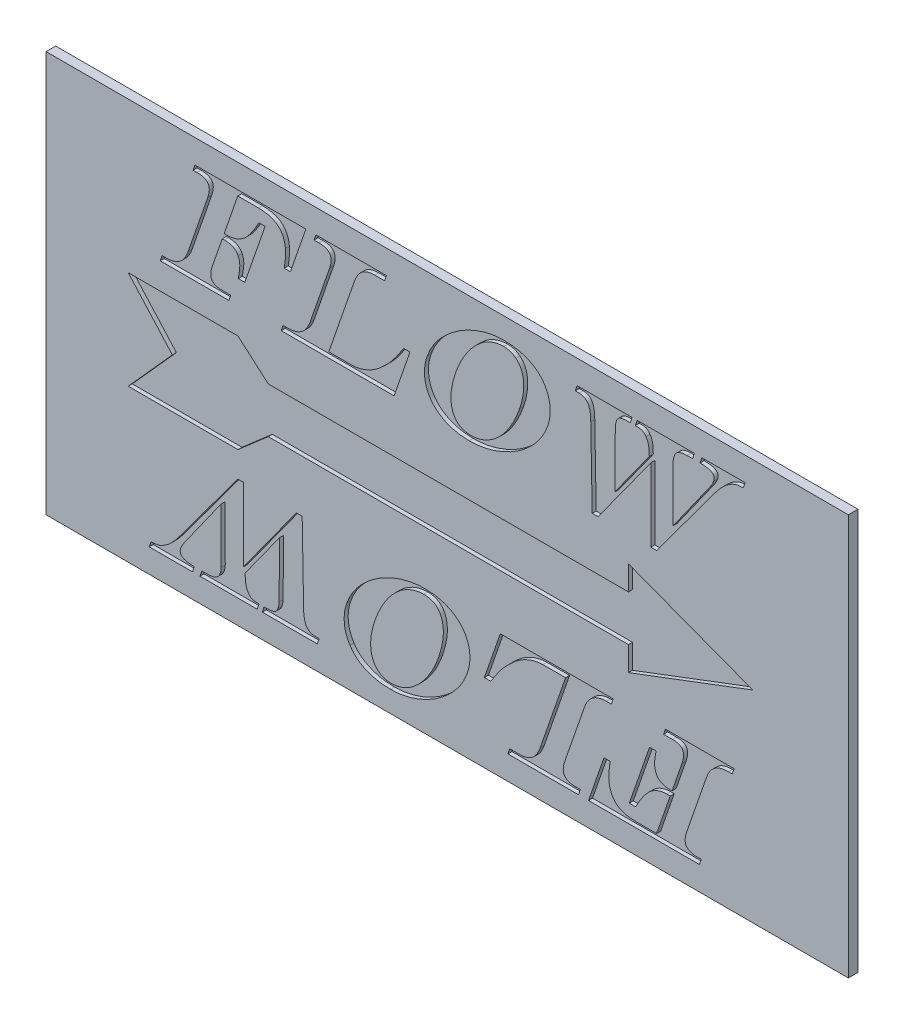
from build123d import *

# Parameters (mm, degrees)
SKETCH1_W           = 50.8
SKETCH1_H           = 25.4
BOSS_EXTRUDE1_DEPTH = 0.6096
CUT_EXTRUDE1_DEPTH  = 0.254
CUT_EXTRUDE2_DEPTH  = 0.254
CIRPATTERN3_COUNT   = 2


with BuildPart() as part:
    # Sketch1 → Boss-Extrude1 (new body)
    with BuildSketch(Plane.XY):
        Rectangle(SKETCH1_W, SKETCH1_H)
    extrude(amount=BOSS_EXTRUDE1_DEPTH)

    # Sketch2 → Cut-Extrude1 (cut)
    with BuildSketch(Plane.XY.offset(0.6096)):
        Polygon((-11.327711753, 1.509598775), (-13.244593022, 3.179140525), (-20.194443984, 3.179140525), (-17.401103691, 0.06572999), (-20.194443984, -3.047680545), (-13.244593022, -3.047680545), (-11.327711753, -1.378138794), (11.478647286, -1.378138794), (11.478647286, -2.916220564), (19.346527111, 0.06572999), (11.478647286, 3.047680545), (11.478647286, 1.509598775), align=None)
    extrude(amount=-CUT_EXTRUDE1_DEPTH, mode=Mode.SUBTRACT)

    # Sketch3 → Cut-Extrude2 (cut)
    # profile 1 of 4: a face of its own
    with BuildSketch(Plane.XY.offset(0.6096)):
        with BuildLine():
            Line((-13.259375867, 10.848866034), (-14.120165563, 8.36035252))
            Line((-14.120165563, 8.36035252), (-13.901616154, 8.36035252))
            add(Edge.make_bspline(
                [(-13.901616154, 8.36035252), (-13.853736727, 8.36123528), (-13.759434535, 8.362973942), (-13.61991226, 8.381258622), (-13.484298786, 8.410384357), (-13.352663489, 8.452540432), (-13.224510463, 8.50470564), (-13.100654621, 8.569428516), (-12.981479527, 8.646482671), (-12.863842128, 8.734424076), (-12.750015502, 8.839514368), (-12.633589479, 8.958785147), (-12.519350248, 9.098524935), (-12.400815077, 9.252921036), (-12.284659851, 9.427887506), (-12.165732759, 9.618546494), (-12.04584109, 9.827393051), (-11.96903337, 9.973952228), (-11.929308299, 10.049752858)],
                knots=[0, 0, 0, 0, 0.835921273, 1.646410856, 2.453396133, 3.255837111, 4.057556213, 4.867669717, 5.692766577, 6.53435567, 7.429735418, 8.395931348, 9.443481709, 10.580182804, 11.794901575, 13.109847871, 14.505208907, 16, 16, 16, 16], degree=3))
            Line((-11.929308299, 10.049752858), (-11.528410917, 10.049752858))
            Line((-11.528410917, 10.049752858), (-12.814232286, 6.33843529))
            Line((-12.814232286, 6.33843529), (-13.224515225, 6.33843529))
            add(Edge.make_bspline(
                [(-13.224515225, 6.33843529), (-13.209247687, 6.420575718), (-13.180859041, 6.573308627), (-13.148946441, 6.786523134), (-13.132463527, 6.966007982), (-13.127562639, 7.116348587), (-13.139929518, 7.245841422), (-13.158697106, 7.365330987), (-13.192423674, 7.477536098), (-13.22295389, 7.548095875), (-13.237923164, 7.582692047)],
                knots=[0, 0, 0, 0, 1.58301381, 2.943475083, 4.082757694, 4.997482363, 5.787935338, 6.543887119, 7.286053135, 8, 8, 8, 8], degree=3))
            add(Edge.make_bspline(
                [(-13.237923164, 7.582692047), (-13.255967714, 7.617382738), (-13.291634178, 7.685951601), (-13.365435188, 7.775676962), (-13.454613932, 7.849662631), (-13.556265061, 7.913193242), (-13.674552035, 7.958433838), (-13.805087168, 7.99397378), (-13.950638563, 8.013639571), (-14.052176308, 8.01591577), (-14.10541683, 8.017109277)],
                knots=[0, 0, 0, 0, 0.910688587, 1.800047178, 2.688059461, 3.605649105, 4.583658891, 5.630999447, 6.757833114, 8, 8, 8, 8], degree=3))
            Line((-14.10541683, 8.017109277), (-14.239496222, 8.017109277))
            Line((-14.239496222, 8.017109277), (-14.860283806, 6.224467807))
            add(Edge.make_bspline(
                [(-14.860283806, 6.224467807), (-14.875112021, 6.179483697), (-14.9033827, 6.093719407), (-14.935669905, 5.968377043), (-14.958409856, 5.852938465), (-14.967086005, 5.746913332), (-14.968845849, 5.651079552), (-14.95650563, 5.565298269), (-14.934399505, 5.489300263), (-14.899914334, 5.423008356), (-14.854906158, 5.366223784), (-14.800349535, 5.31678894), (-14.734796145, 5.276974178), (-14.660445662, 5.243471261), (-14.576469559, 5.21637515), (-14.482400793, 5.198218976), (-14.378283385, 5.187733188), (-14.30566774, 5.186170565), (-14.267652894, 5.18535252)],
                knots=[0, 0, 0, 0, 1.487891068, 2.836733282, 4.065205791, 5.178995715, 6.176090192, 7.069818416, 7.891698109, 8.651740206, 9.401856929, 10.157605336, 10.952526785, 11.800973151, 12.715856344, 13.718375481, 14.805552092, 16, 16, 16, 16], degree=3))
            Line((-14.267652894, 5.18535252), (-13.700497066, 5.18535252))
            Line((-13.700497066, 5.18535252), (-13.819827725, 4.842109277))
            Line((-13.819827725, 4.842109277), (-18.168022404, 4.842109277))
            Line((-18.168022404, 4.842109277), (-18.048691745, 5.18535252))
            Line((-18.048691745, 5.18535252), (-17.80734884, 5.18535252))
            add(Edge.make_bspline(
                [(-17.80734884, 5.18535252), (-17.763511562, 5.186032071), (-17.677898825, 5.187359211), (-17.552643563, 5.200436853), (-17.433051083, 5.217809347), (-17.320431066, 5.246841063), (-17.213507306, 5.281443881), (-17.112805731, 5.324183714), (-17.018305039, 5.375703638), (-16.929534282, 5.434473658), (-16.846781124, 5.502668053), (-16.768920344, 5.579542826), (-16.695210117, 5.664762548), (-16.628358483, 5.759842855), (-16.564887472, 5.862188874), (-16.505898354, 5.973575035), (-16.452316015, 6.094160171), (-16.421789281, 6.178678069), (-16.406219195, 6.221786219)],
                knots=[0, 0, 0, 0, 1.115139241, 2.177829621, 3.202531188, 4.187320628, 5.133249574, 6.060672428, 6.966574419, 7.868756059, 8.765833071, 9.690741823, 10.650518341, 11.628916185, 12.645251667, 13.713708509, 14.833882525, 16, 16, 16, 16], degree=3))
            Line((-16.406219195, 6.221786219), (-15.161962438, 9.812432334))
            add(Edge.make_bspline(
                [(-15.161962438, 9.812432334), (-15.148169353, 9.855665006), (-15.121757023, 9.938451099), (-15.089981057, 10.058963926), (-15.0709635, 10.171182512), (-15.062574465, 10.273931284), (-15.064252307, 10.368612637), (-15.079232952, 10.453718453), (-15.102839583, 10.531289047), (-15.139946104, 10.599088719), (-15.187540168, 10.659496052), (-15.247839928, 10.710934975), (-15.319693038, 10.75372665), (-15.40295288, 10.788309803), (-15.497075466, 10.817005565), (-15.603935372, 10.834256334), (-15.721662652, 10.846952038), (-15.804162038, 10.84821078), (-15.84710813, 10.848866034)],
                knots=[0, 0, 0, 0, 1.369935481, 2.623284654, 3.758979805, 4.801050224, 5.73242248, 6.608603103, 7.402254699, 8.168955411, 8.927540133, 9.711962908, 10.547299015, 11.441983851, 12.428043378, 13.51055757, 14.704089432, 16, 16, 16, 16], degree=3))
            Line((-15.84710813, 10.848866034), (-16.088451036, 10.848866034))
            Line((-16.088451036, 10.848866034), (-15.969120377, 11.192109277))
            Line((-15.969120377, 11.192109277), (-8.947382624, 11.192109277))
            Line((-8.947382624, 11.192109277), (-9.927502978, 8.361693314))
            Line((-9.927502978, 8.361693314), (-10.316333215, 8.361693314))
            add(Edge.make_bspline(
                [(-10.316333215, 8.361693314), (-10.306552274, 8.426445573), (-10.287828465, 8.550401838), (-10.267162283, 8.729416108), (-10.249079434, 8.892457174), (-10.236936471, 9.040432649), (-10.229696221, 9.172360958), (-10.228950174, 9.288153351), (-10.229589519, 9.387724334), (-10.237589746, 9.448223137), (-10.241248755, 9.475893061)],
                knots=[0, 0, 0, 0, 1.403576064, 2.68688767, 3.862250417, 4.919559254, 5.869176888, 6.693102873, 7.402273387, 8, 8, 8, 8], degree=3))
            add(Edge.make_bspline(
                [(-10.241248755, 9.475893061), (-10.251242505, 9.551269771), (-10.270476069, 9.696336712), (-10.324467798, 9.901584715), (-10.396836139, 10.086030359), (-10.488297776, 10.250591543), (-10.600776684, 10.394642004), (-10.7344338, 10.518404467), (-10.88868011, 10.622325721), (-11.064532016, 10.705207849), (-11.25962378, 10.771305336), (-11.475893838, 10.815141812), (-11.711755935, 10.844223874), (-11.87602683, 10.847277441), (-11.961487353, 10.848866034)],
                knots=[0, 0, 0, 0, 1.10546836, 2.127539288, 3.079077017, 3.981649112, 4.857109305, 5.726754031, 6.621326112, 7.552038254, 8.547320977, 9.610993619, 10.75713994, 12, 12, 12, 12], degree=3))
            Line((-11.961487353, 10.848866034), (-13.259375867, 10.848866034))
        make_face()
    # profile 2 of 4: a face of its own
    with BuildSketch(Plane.XY.offset(0.6096)):
        with BuildLine():
            Line((-8.311846306, 11.192109277), (-3.844320968, 11.192109277))
            Line((-3.844320968, 11.192109277), (-3.963651627, 10.848866034))
            Line((-3.963651627, 10.848866034), (-4.584439211, 10.848866034))
            add(Edge.make_bspline(
                [(-4.584439211, 10.848866034), (-4.660641359, 10.846232708), (-4.808168462, 10.841134599), (-5.019723417, 10.796247564), (-5.211857348, 10.721840512), (-5.356750547, 10.635259718), (-5.460488531, 10.54891264), (-5.534941469, 10.474732701), (-5.604475754, 10.38922411), (-5.671596343, 10.294716798), (-5.732961442, 10.188621765), (-5.792548546, 10.073771977), (-5.845314928, 9.947139127), (-5.877738784, 9.859033076), (-5.89439487, 9.813773128)],
                knots=[0, 0, 0, 0, 1.515961848, 2.934897059, 4.281708241, 5.603354257, 6.273311375, 6.965476594, 7.692406687, 8.465170106, 9.270991904, 10.130637515, 11.039711271, 12, 12, 12, 12], degree=3))
            Line((-5.89439487, 9.813773128), (-7.496643603, 5.18535252))
            Line((-7.496643603, 5.18535252), (-6.060653316, 5.18535252))
            add(Edge.make_bspline(
                [(-6.060653316, 5.18535252), (-5.984496146, 5.187483928), (-5.829866407, 5.191811546), (-5.598086029, 5.233956634), (-5.362644858, 5.294543178), (-5.128113958, 5.384703198), (-4.894210941, 5.493693573), (-4.665991203, 5.624208968), (-4.445126936, 5.774697388), (-4.306091221, 5.888217801), (-4.235832792, 5.945582672)],
                knots=[0, 0, 0, 0, 0.905491289, 1.838512123, 2.795808633, 3.795605345, 4.823543727, 5.864609099, 6.920930422, 8, 8, 8, 8], degree=3))
            add(Edge.make_bspline(
                [(-4.235832792, 5.945582672), (-4.150701622, 6.021742916), (-3.986421099, 6.168711936), (-3.791707939, 6.360977987), (-3.643467531, 6.518682982), (-3.533515697, 6.649490461), (-3.416963893, 6.789530621), (-3.300317726, 6.946114663), (-3.175481015, 7.117787542), (-3.043242552, 7.309185335), (-2.90271269, 7.521819437), (-2.806011757, 7.670233423), (-2.755596306, 7.747609699)],
                knots=[0, 0, 0, 0, 1.463045253, 2.823288302, 3.503831384, 4.234720844, 5.01175685, 5.837326203, 6.735148315, 7.730891246, 8.816990291, 10, 10, 10, 10], degree=3))
            Line((-2.755596306, 7.747609699), (-2.356039718, 7.747609699))
            Line((-2.356039718, 7.747609699), (-3.361635157, 4.842109277))
            Line((-3.361635157, 4.842109277), (-10.506725951, 4.842109277))
            Line((-10.506725951, 4.842109277), (-10.400803232, 5.18535252))
            Line((-10.400803232, 5.18535252), (-10.084375867, 5.18535252))
            add(Edge.make_bspline(
                [(-10.084375867, 5.18535252), (-10.041886077, 5.186099618), (-9.958072458, 5.187573312), (-9.835330359, 5.199934429), (-9.717614171, 5.219334092), (-9.606042446, 5.249960695), (-9.498887312, 5.285201888), (-9.397184048, 5.329679955), (-9.301750138, 5.384131915), (-9.21092423, 5.445216552), (-9.125231115, 5.514733199), (-9.044885212, 5.591935767), (-8.971247897, 5.679085847), (-8.900916388, 5.772283581), (-8.838504399, 5.875511557), (-8.778823247, 5.984916471), (-8.726969408, 6.103852911), (-8.696261766, 6.186329703), (-8.680564634, 6.228490189)],
                knots=[0, 0, 0, 0, 1.080834128, 2.132009167, 3.1359294, 4.11235942, 5.072496658, 6.004268698, 6.930961408, 7.864535852, 8.786261539, 9.73522259, 10.694820954, 11.686429042, 12.702575872, 13.760800713, 14.855366119, 16, 16, 16, 16], degree=3))
            Line((-8.680564634, 6.228490189), (-7.438989465, 9.813773128))
            add(Edge.make_bspline(
                [(-7.438989465, 9.813773128), (-7.425417411, 9.855160732), (-7.399240969, 9.934985074), (-7.371431666, 10.052500614), (-7.353081578, 10.162252953), (-7.346307587, 10.263713972), (-7.349079842, 10.357591632), (-7.366256187, 10.442910196), (-7.390264974, 10.521630925), (-7.429065246, 10.591089194), (-7.477877713, 10.652420317), (-7.538481681, 10.705487276), (-7.609349176, 10.750838385), (-7.691706332, 10.787353845), (-7.78459075, 10.814996208), (-7.888357057, 10.834741152), (-8.002732443, 10.846812356), (-8.082539081, 10.848162384), (-8.124135157, 10.848866034)],
                knots=[0, 0, 0, 0, 1.329031412, 2.56330513, 3.682510207, 4.72160118, 5.663840729, 6.538787221, 7.371442573, 8.165188438, 8.951394843, 9.753537901, 10.612598371, 11.510225422, 12.494207784, 13.564447061, 14.73056365, 16, 16, 16, 16], degree=3))
            Line((-8.124135157, 10.848866034), (-8.431176965, 10.848866034))
            Line((-8.431176965, 10.848866034), (-8.311846306, 11.192109277))
        make_face()
    # profile 3 of 4: a face of its own
    with BuildSketch(Plane.XY.offset(0.6096)):
        with BuildLine():
            add(Edge.make_bspline(
                [(3.587699724, 11.363730898), (3.662368413, 11.363243681), (3.809179263, 11.362285732), (4.025164761, 11.346273376), (4.233321914, 11.324326596), (4.433382374, 11.292073019), (4.625470447, 11.250714824), (4.809842736, 11.199469176), (4.986553351, 11.139818902), (5.154560018, 11.069488247), (5.313580325, 10.992222467), (5.463503696, 10.90763185), (5.602805756, 10.814694322), (5.733711621, 10.715987698), (5.853022032, 10.607909752), (5.963654943, 10.493631343), (6.064720476, 10.372075449), (6.123403686, 10.284910318), (6.152638491, 10.241486388)],
                knots=[0, 0, 0, 0, 1.226907228, 2.412300225, 3.557690248, 4.666286615, 5.741101131, 6.785437922, 7.809847966, 8.804324582, 9.7767453, 10.714276506, 11.631060663, 12.527249664, 13.406296191, 14.273850611, 15.140066813, 16, 16, 16, 16], degree=3))
            add(Edge.make_bspline(
                [(6.152638491, 10.241486388), (6.201699552, 10.15856654), (6.298571523, 9.994839768), (6.405741992, 9.731639765), (6.480266974, 9.460690533), (6.520206948, 9.18182603), (6.527393359, 8.898540617), (6.506142736, 8.61223414), (6.452976762, 8.324250628), (6.393330101, 8.136342968), (6.363143137, 8.041243567)],
                knots=[0, 0, 0, 0, 1.009060396, 1.992408371, 2.968921779, 3.949060082, 4.93820806, 5.934467647, 6.95464139, 8, 8, 8, 8], degree=3))
            add(Edge.make_bspline(
                [(6.363143137, 8.041243567), (6.336291701, 7.968500705), (6.282421131, 7.822560668), (6.185482666, 7.608513763), (6.07212861, 7.399709807), (5.945783877, 7.1935823), (5.804717486, 6.99163827), (5.6504664, 6.792038814), (5.479539193, 6.598464936), (5.296590966, 6.408272843), (5.101522361, 6.225697357), (4.897461551, 6.051306232), (4.685736081, 5.885527816), (4.463477292, 5.732020331), (4.234231165, 5.58513305), (3.995842976, 5.448421187), (3.748141992, 5.322894435), (3.494751048, 5.204669369), (3.236184266, 5.099294818), (2.975160585, 5.008058698), (2.713660057, 4.929595592), (2.450690529, 4.867232835), (2.187332459, 4.816656505), (1.922675268, 4.782588929), (1.65735789, 4.759804897), (1.48001872, 4.757466132), (1.391479285, 4.756298466)],
                knots=[0, 0, 0, 0, 0.884504431, 1.774532993, 2.67800114, 3.593661773, 4.531501607, 5.487233868, 6.470126639, 7.476275611, 8.497201687, 9.517095746, 10.538123693, 11.563687334, 12.597734781, 13.643857171, 14.697459211, 15.765181815, 16.833306165, 17.881563956, 18.918962943, 19.946742652, 20.963841199, 21.977097758, 22.990033494, 24, 24, 24, 24], degree=3))
            add(Edge.make_bspline(
                [(1.391479285, 4.756298466), (1.264868433, 4.759495175), (1.017948439, 4.765729487), (0.658907311, 4.811009643), (0.322429218, 4.888945136), (0.009850823, 4.996965321), (-0.27738608, 5.133790925), (-0.536616085, 5.297755986), (-0.76703531, 5.488601893), (-0.934758877, 5.668774801), (-1.051310666, 5.825325325), (-1.130540389, 5.946938227), (-1.200103198, 6.07366444), (-1.26250957, 6.203968253), (-1.314885591, 6.339820732), (-1.357197056, 6.480790829), (-1.392713612, 6.626086042), (-1.417758605, 6.775788997), (-1.433799578, 6.92892191), (-1.440872679, 7.084763019), (-1.436407097, 7.242398481), (-1.422786237, 7.401727058), (-1.400296716, 7.563037149), (-1.366107703, 7.726194844), (-1.323962513, 7.891729582), (-1.287243459, 8.000786454), (-1.26865585, 8.055992301)],
                knots=[0, 0, 0, 0, 1.787327059, 3.485694765, 5.098939096, 6.655470209, 8.14565291, 9.581057397, 10.974704654, 12.358906261, 13.044170513, 13.728504489, 14.406349524, 15.083753875, 15.766923224, 16.459555965, 17.160502825, 17.877316892, 18.600628104, 19.333264634, 20.078082068, 20.82532784, 21.590085138, 22.375898506, 23.177861099, 24, 24, 24, 24], degree=3))
            add(Edge.make_bspline(
                [(-1.26865585, 8.055992301), (-1.241395569, 8.12965131), (-1.186705517, 8.277427304), (-1.087931044, 8.493632647), (-0.975517696, 8.706403786), (-0.845777148, 8.913259732), (-0.704817611, 9.118705446), (-0.548196365, 9.319383351), (-0.375314139, 9.514960542), (-0.191440519, 9.707764967), (0.004574974, 9.892510322), (0.208935944, 10.068902779), (0.420941336, 10.234810406), (0.639226749, 10.392073311), (0.865436769, 10.538404004), (1.098549104, 10.675647577), (1.340339296, 10.801024414), (1.587290114, 10.917808401), (1.838059792, 11.021522494), (2.089337129, 11.113214744), (2.339775374, 11.191170145), (2.589903679, 11.254634044), (2.839806202, 11.30276144), (3.089515811, 11.337489754), (3.338785878, 11.36015747), (3.504969739, 11.36254322), (3.587699724, 11.363730898)],
                knots=[0, 0, 0, 0, 0.909613569, 1.824882668, 2.751359265, 3.695334997, 4.651836311, 5.63678154, 6.64207872, 7.674735924, 8.722213324, 9.761146563, 10.801046942, 11.839889869, 12.876756862, 13.921030372, 14.972416046, 16.03089142, 17.084721943, 18.114949102, 19.128650846, 20.121943447, 21.102838669, 22.075224971, 23.041804609, 24, 24, 24, 24], degree=3))
        make_face()
        with BuildLine():
            add(Edge.make_bspline(
                [(3.585018137, 11.020487655), (3.525511672, 11.018803656), (3.406075563, 11.015423682), (3.226975159, 10.99212384), (3.047883396, 10.952459234), (2.868313832, 10.89915), (2.688752818, 10.829506435), (2.512483851, 10.739919373), (2.336424679, 10.63594282), (2.225621334, 10.553176022), (2.169139758, 10.510985966)],
                knots=[0, 0, 0, 0, 0.931987919, 1.870603694, 2.823520246, 3.802462728, 4.802135171, 5.835244061, 6.89652403, 8, 8, 8, 8], degree=3))
            add(Edge.make_bspline(
                [(2.169139758, 10.510985966), (2.117269122, 10.469085808), (2.010520288, 10.382856039), (1.854556898, 10.238363191), (1.698291156, 10.075616758), (1.540642229, 9.897519012), (1.388309604, 9.703787536), (1.239381865, 9.500364511), (1.102217782, 9.283343944), (0.970410438, 9.056984595), (0.847215372, 8.819904999), (0.732926499, 8.571318876), (0.625752463, 8.312418959), (0.56170195, 8.13403191), (0.529348795, 8.043925155)],
                knots=[0, 0, 0, 0, 0.799370464, 1.645089999, 2.547089665, 3.503936107, 4.495711611, 5.501204713, 6.525459319, 7.572384686, 8.641406164, 9.727590643, 10.852162009, 12, 12, 12, 12], degree=3))
            add(Edge.make_bspline(
                [(0.529348795, 8.043925155), (0.492209721, 7.932612044), (0.420444941, 7.717518885), (0.338783071, 7.398458493), (0.280227158, 7.096740346), (0.245875936, 6.812181813), (0.235846958, 6.546168368), (0.248711965, 6.300179614), (0.282643305, 6.073762365), (0.339748967, 5.868785814), (0.417126623, 5.68544245), (0.5154154, 5.527119945), (0.632207753, 5.39278343), (0.76825219, 5.284235609), (0.922081001, 5.20006248), (1.093418762, 5.141172984), (1.281458944, 5.106226111), (1.412331537, 5.101819316), (1.479971684, 5.099541709)],
                knots=[0, 0, 0, 0, 1.523101799, 2.94312839, 4.272331675, 5.510997254, 6.660621057, 7.724072972, 8.704773557, 9.626960141, 10.47954101, 11.279746897, 12.036307602, 12.779397307, 13.527296996, 14.301715397, 15.12225915, 16, 16, 16, 16], degree=3))
            add(Edge.make_bspline(
                [(1.479971684, 5.099541709), (1.532323383, 5.100406476), (1.636873763, 5.102133483), (1.79209583, 5.121225563), (1.946742698, 5.146673397), (2.098841212, 5.188467792), (2.251275537, 5.237165317), (2.401378639, 5.299665707), (2.550518701, 5.372096778), (2.69811899, 5.45562803), (2.844088002, 5.54894875), (2.986090295, 5.653830131), (3.124433372, 5.768894729), (3.261672901, 5.891529957), (3.393929516, 6.026038499), (3.523259191, 6.170081973), (3.648816631, 6.324454303), (3.815280975, 6.544651351), (4.011533119, 6.843501439), (4.223975178, 7.232291737), (4.418619171, 7.653070763), (4.52703661, 7.949662729), (4.582568812, 8.101579294)],
                knots=[0, 0, 0, 0, 0.683150323, 1.364303855, 2.039708942, 2.727603162, 3.421461396, 4.128012767, 4.848334456, 5.5851782, 6.341115328, 7.109096728, 7.88839038, 8.689957126, 9.511103009, 10.349972622, 11.21671365, 12.108378405, 13.953461577, 15.878304068, 17.888837337, 20, 20, 20, 20], degree=3))
            add(Edge.make_bspline(
                [(4.582568812, 8.101579294), (4.615510279, 8.200878049), (4.679689132, 8.394338776), (4.753384293, 8.683283307), (4.806087457, 8.961849947), (4.839074731, 9.229238568), (4.849827488, 9.483003818), (4.84164797, 9.720896945), (4.811228427, 9.941153114), (4.760326637, 10.144053401), (4.690264005, 10.329394657), (4.59687358, 10.493728943), (4.484901967, 10.64013091), (4.393645754, 10.71934807), (4.347929876, 10.759032841)],
                knots=[0, 0, 0, 0, 1.330021898, 2.591240996, 3.788345695, 4.933125704, 6.013876718, 7.014898012, 7.956052113, 8.83545072, 9.670271047, 10.466821773, 11.231936266, 12, 12, 12, 12], degree=3))
            add(Edge.make_bspline(
                [(4.347929876, 10.759032841), (4.324250145, 10.778444442), (4.275875202, 10.818100091), (4.192915803, 10.866643649), (4.102260059, 10.91185171), (3.969900848, 10.961761805), (3.797453884, 11.01092495), (3.655119942, 11.017332052), (3.585018137, 11.020487655)],
                knots=[0, 0, 0, 0, 0.669935228, 1.368599894, 2.099990106, 2.887448721, 4.467017341, 6, 6, 6, 6], degree=3))
        make_face(mode=Mode.SUBTRACT)
    # profile 4 of 4: a face of its own
    with BuildSketch(Plane.XY.offset(0.6096)):
        with BuildLine():
            Line((8.226846684, 11.192109277), (11.702184522, 11.192109277))
            Line((11.702184522, 11.192109277), (11.600284184, 10.850206828))
            add(Edge.make_bspline(
                [(11.600284184, 10.850206828), (11.560502396, 10.849450885), (11.484052461, 10.847998165), (11.375009333, 10.843743593), (11.276049527, 10.839450379), (11.18850222, 10.829564107), (11.111551984, 10.81904817), (11.045199051, 10.807223589), (10.989206257, 10.793452616), (10.930260406, 10.770054408), (10.867106295, 10.733422055), (10.805180056, 10.673093837), (10.754023431, 10.598762609), (10.731247133, 10.541931192), (10.719382579, 10.51232676)],
                knots=[0, 0, 0, 0, 1.405838568, 2.701644983, 3.856186815, 4.904301425, 5.813265117, 6.600015037, 7.285647694, 7.845761322, 8.837012985, 9.84225478, 10.875994565, 12, 12, 12, 12], degree=3))
            add(Edge.make_bspline(
                [(10.719382579, 10.51232676), (10.697491961, 10.441816396), (10.655282802, 10.30585938), (10.647867621, 10.163748726), (10.64429812, 10.095339851)],
                knots=[0, 0, 0, 0, 1.03724496, 2, 2, 2, 2], degree=3))
            Line((10.64429812, 10.095339851), (10.612119066, 6.558325493))
            Line((10.612119066, 6.558325493), (12.79627236, 9.595223719))
            add(Edge.make_bspline(
                [(12.79627236, 9.595223719), (12.795003421, 9.659154818), (12.792632288, 9.778616207), (12.781744173, 9.944967352), (12.767739997, 10.08552289), (12.749193713, 10.204021927), (12.72313799, 10.306980988), (12.687985703, 10.401966584), (12.642847843, 10.491454379), (12.605575678, 10.546653752), (12.587108508, 10.57400328)],
                knots=[0, 0, 0, 0, 1.50778996, 2.817450133, 3.930192162, 4.838151059, 5.643399364, 6.430438548, 7.222332354, 8, 8, 8, 8], degree=3))
            add(Edge.make_bspline(
                [(12.587108508, 10.57400328), (12.57123012, 10.598604267), (12.540585023, 10.646083874), (12.485439569, 10.707419958), (12.423792812, 10.75443107), (12.35664645, 10.79379714), (12.274153509, 10.818488262), (12.173580942, 10.837104535), (12.050507427, 10.846503554), (11.960966215, 10.848038469), (11.912689167, 10.848866034)],
                knots=[0, 0, 0, 0, 0.910504991, 1.757263608, 2.550218711, 3.316244027, 4.165170459, 5.212721104, 6.497210471, 8, 8, 8, 8], degree=3))
            Line((11.912689167, 10.848866034), (12.032019826, 11.192109277))
            Line((12.032019826, 11.192109277), (15.652163407, 11.192109277))
            Line((15.652163407, 11.192109277), (15.532832748, 10.848866034))
            Line((15.532832748, 10.848866034), (15.197634268, 10.848866034))
            add(Edge.make_bspline(
                [(15.197634268, 10.848866034), (15.144840451, 10.847578675), (15.044252716, 10.845125877), (14.901170265, 10.82685139), (14.773471463, 10.795007264), (14.661169684, 10.749610348), (14.56261352, 10.690517637), (14.48292422, 10.612187072), (14.41738922, 10.518729938), (14.389050577, 10.447357797), (14.374386802, 10.410426422)],
                knots=[0, 0, 0, 0, 1.262147905, 2.404762643, 3.44152608, 4.400047313, 5.292680594, 6.169370983, 7.052744599, 8, 8, 8, 8], degree=3))
            add(Edge.make_bspline(
                [(14.374386802, 10.410426422), (14.356596133, 10.350486388), (14.320323021, 10.228275603), (14.31083884, 10.101130089), (14.306006312, 10.036344919)],
                knots=[0, 0, 0, 0, 0.980928727, 2, 2, 2, 2], degree=3))
            Line((14.306006312, 10.036344919), (14.310028694, 6.558325493))
            Line((14.310028694, 6.558325493), (16.618875822, 9.81109154))
            add(Edge.make_bspline(
                [(16.618875822, 9.81109154), (16.647595679, 9.852290949), (16.702449398, 9.930980086), (16.771945916, 10.048998981), (16.828072542, 10.159023314), (16.856279824, 10.231421477), (16.869604285, 10.265620679)],
                knots=[0, 0, 0, 0, 1.157135236, 2.210079636, 3.154483415, 4, 4, 4, 4], degree=3))
            add(Edge.make_bspline(
                [(16.869604285, 10.265620679), (16.882391137, 10.308992018), (16.906108919, 10.389439652), (16.903040699, 10.509840582), (16.864623662, 10.615549112), (16.798928609, 10.682763718), (16.732675693, 10.72896746), (16.66650214, 10.757170997), (16.589335358, 10.784484918), (16.498610595, 10.804433476), (16.396468961, 10.824316343), (16.281123405, 10.835993134), (16.153392349, 10.847943355), (16.063821382, 10.850307894), (16.016859353, 10.851547621)],
                knots=[0, 0, 0, 0, 1.285541411, 2.384495581, 3.382986795, 4.422452083, 5.010462446, 5.684778399, 6.468283552, 7.347984699, 8.334893335, 9.440579406, 10.658096596, 12, 12, 12, 12], degree=3))
            Line((16.016859353, 10.851547621), (16.121441278, 11.192109277))
            Line((16.121441278, 11.192109277), (18.867387224, 11.192109277))
            Line((18.867387224, 11.192109277), (18.752078947, 10.859592385))
            add(Edge.make_bspline(
                [(18.752078947, 10.859592385), (18.695292738, 10.8554739), (18.590954602, 10.847906656), (18.448501275, 10.832685593), (18.334671851, 10.813307853), (18.242147123, 10.789761607), (18.15925503, 10.754669483), (18.069208642, 10.711157959), (17.964790605, 10.656826199), (17.892387053, 10.613314143), (17.853747022, 10.590092807)],
                knots=[0, 0, 0, 0, 1.434773354, 2.636231243, 3.608341574, 4.343261887, 5.035520549, 5.871761476, 6.864210371, 8, 8, 8, 8], degree=3))
            add(Edge.make_bspline(
                [(17.853747022, 10.590092807), (17.819976199, 10.567663256), (17.749563756, 10.520897456), (17.644448695, 10.440248441), (17.538687006, 10.344391422), (17.427188566, 10.238492203), (17.315802681, 10.116902924), (17.198594745, 9.98451219), (17.079324925, 9.838131978), (17.001109289, 9.734480998), (16.960778272, 9.68103453)],
                knots=[0, 0, 0, 0, 0.759479819, 1.583521684, 2.47920375, 3.432676195, 4.463570603, 5.567196277, 6.745551996, 8, 8, 8, 8], degree=3))
            Line((16.960778272, 9.68103453), (13.257505468, 4.670487655))
            Line((13.257505468, 4.670487655), (12.894150316, 4.670487655))
            Line((12.894150316, 4.670487655), (12.899513491, 9.304271439))
            Line((12.899513491, 9.304271439), (9.55289187, 4.670487655))
            Line((9.55289187, 4.670487655), (9.181491954, 4.670487655))
            Line((9.181491954, 4.670487655), (9.090317968, 9.639469919))
            add(Edge.make_bspline(
                [(9.090317968, 9.639469919), (9.089227206, 9.692210219), (9.087136905, 9.79328012), (9.080137097, 9.939261962), (9.064385863, 10.073272178), (9.047281382, 10.196347611), (9.021156334, 10.307295677), (8.990922122, 10.406574867), (8.955079111, 10.494461481), (8.912739118, 10.570593201), (8.865939745, 10.637965408), (8.810393825, 10.694074694), (8.749139588, 10.741964771), (8.681374294, 10.780963376), (8.60759471, 10.812016955), (8.526793353, 10.833237389), (8.440065005, 10.847052438), (8.379753074, 10.848251716), (8.34885893, 10.848866034)],
                knots=[0, 0, 0, 0, 1.567024216, 3.002997369, 4.338562592, 5.573976071, 6.691413764, 7.720163876, 8.65456078, 9.504301384, 10.303707174, 11.082905485, 11.839729789, 12.607076484, 13.398505742, 14.2100551, 15.083119832, 16, 16, 16, 16], degree=3))
            Line((8.34885893, 10.848866034), (8.107516025, 10.848866034))
            Line((8.107516025, 10.848866034), (8.226846684, 11.192109277))
        make_face()
    cut_extrude2 = extrude(amount=-CUT_EXTRUDE2_DEPTH, mode=Mode.SUBTRACT)

    # CirPattern3: Cut-Extrude2 ×2 about axis
    cirpattern3_axis = Axis((0, 0, -0.03048), (0, 0, 1))
    for i in range(1, CIRPATTERN3_COUNT):
        add(cut_extrude2.rotate(cirpattern3_axis, i * 360 / CIRPATTERN3_COUNT), mode=Mode.SUBTRACT)


solid = part.part
